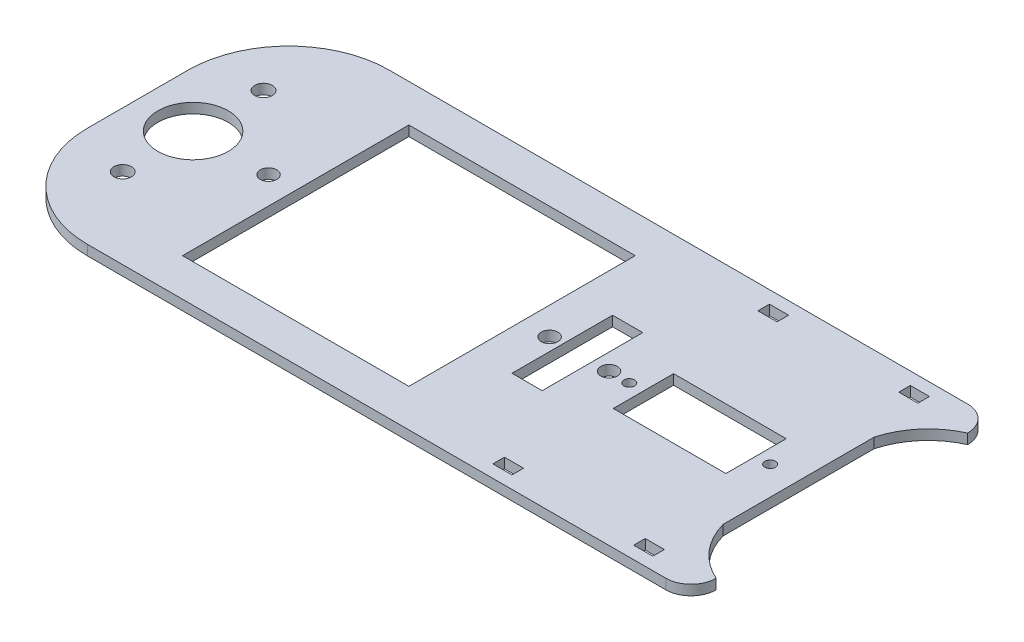
from build123d import *

# Parameters (mm, degrees)
CROQUIS1_R              = 1.75
CROQUIS1_R_2            = 1.05
CROQUIS1_R_3            = 1.65
CROQUIS1_R_4            = 7
CROQUIS1_W              = 22.4
CROQUIS1_H              = 12
CROQUIS1_W_2            = 3.8
CROQUIS1_H_2            = 2.3
CROQUIS1_W_3            = 6
CROQUIS1_H_3            = 20
CROQUIS1_W_4            = 45
CROQUIS1_H_4            = 45
SALIENTE_EXTRUIR1_DEPTH = 2


with BuildPart() as part:
    # Croquis1 → Saliente-Extruir1 (new body)
    with BuildSketch(Plane(origin=(0, 0, 0), x_dir=(1, 0, 0), z_dir=(0, 1, 0))):
        with BuildLine():
            Line((-50, -30), (65, -30))
            ThreePointArc((65, -30), (68.535533906, -28.535533906), (70, -25))
            ThreePointArc((70, -25), (64.574669497, -20.968704233), (61.402899266, -15))
            Line((61.402899266, -15), (61.402899266, 15))
            ThreePointArc((61.402899266, 15), (64.574669497, 20.968704233), (70, 25))
            ThreePointArc((70, 25), (68.535533906, 28.535533906), (65, 30))
            Line((65, 30), (-50, 30))
            ThreePointArc((-50, 30), (-64.142135624, 24.142135624), (-70, 10))
            Line((-70, 10), (-70, -10))
            ThreePointArc((-70, -10), (-64.142135624, -24.142135624), (-50, -30))
        make_face()
        with Locations(Location((-59, -14, 0), (0, 0, 270))):
            Circle(CROQUIS1_R, mode=Mode.SUBTRACT)
        with Locations(Location((-59, 14, 0), (0, 0, 90))):
            Circle(CROQUIS1_R, mode=Mode.SUBTRACT)
        with Locations(Location((55.730399266, 0, 0), (0, 0, 270))):
            Circle(CROQUIS1_R_2, mode=Mode.SUBTRACT)
        with Locations(Location((27.730399266, 0, 0), (0, 0, 270))):
            Circle(CROQUIS1_R_2, mode=Mode.SUBTRACT)
        with Locations(Location((-44, 0, 0), (0, 0, 270))):
            Circle(CROQUIS1_R_3, mode=Mode.SUBTRACT)
        with Locations(Location((11.88, 0, 0), (0, 0, 270))):
            Circle(CROQUIS1_R_3, mode=Mode.SUBTRACT)
        with Locations(Location((-59, 0, 0), (0, 0, 270))):
            Circle(CROQUIS1_R_4, mode=Mode.SUBTRACT)
        with Locations(Location((23.702899266, 0, 0), (0, 0, 270))):
            Circle(CROQUIS1_R_3, mode=Mode.SUBTRACT)
        with Locations((41.730399266, 0)):
            Rectangle(CROQUIS1_W, CROQUIS1_H, mode=Mode.SUBTRACT)
        with Locations((30, 26.35)):
            Rectangle(CROQUIS1_W_2, CROQUIS1_H_2, mode=Mode.SUBTRACT)
        with Locations((58, 26.35)):
            Rectangle(CROQUIS1_W_2, CROQUIS1_H_2, mode=Mode.SUBTRACT)
        with Locations((58, -26.35)):
            Rectangle(CROQUIS1_W_2, CROQUIS1_H_2, mode=Mode.SUBTRACT)
        with Locations((30, -26.35)):
            Rectangle(CROQUIS1_W_2, CROQUIS1_H_2, mode=Mode.SUBTRACT)
        with Locations((17.402899266, 0)):
            Rectangle(CROQUIS1_W_3, CROQUIS1_H_3, mode=Mode.SUBTRACT)
        with Locations((-16.095990361, 0)):
            Rectangle(CROQUIS1_W_4, CROQUIS1_H_4, mode=Mode.SUBTRACT)
    extrude(amount=SALIENTE_EXTRUIR1_DEPTH)


solid = part.part
